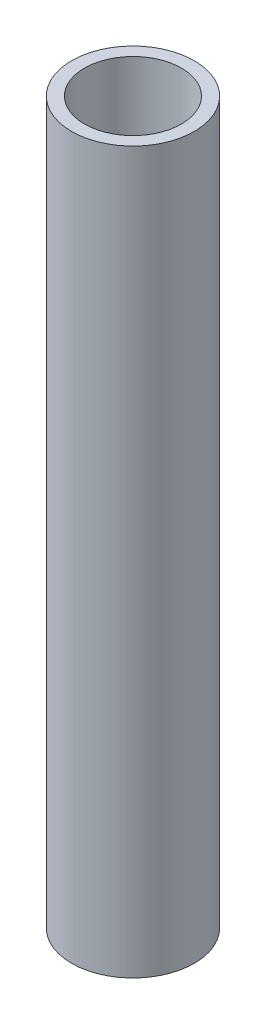
from build123d import *

# Parameters (mm, degrees)
SKETCH1_R           = 1.702
SKETCH1_R_2         = 1.346
BOSS_EXTRUDE1_DEPTH = 20


with BuildPart() as part:
    # Sketch1 → Boss-Extrude1 (new body)
    with BuildSketch(Plane(origin=(0, 0, 0), x_dir=(1, 0, 0), z_dir=(0, 1, 0))):
        with Locations(Location((0, 0, 0), (0, 0, 270))):
            Circle(SKETCH1_R)
        with Locations(Location((0, 0, 0), (0, 0, 270))):
            Circle(SKETCH1_R_2, mode=Mode.SUBTRACT)
    extrude(amount=BOSS_EXTRUDE1_DEPTH)


solid = part.part
